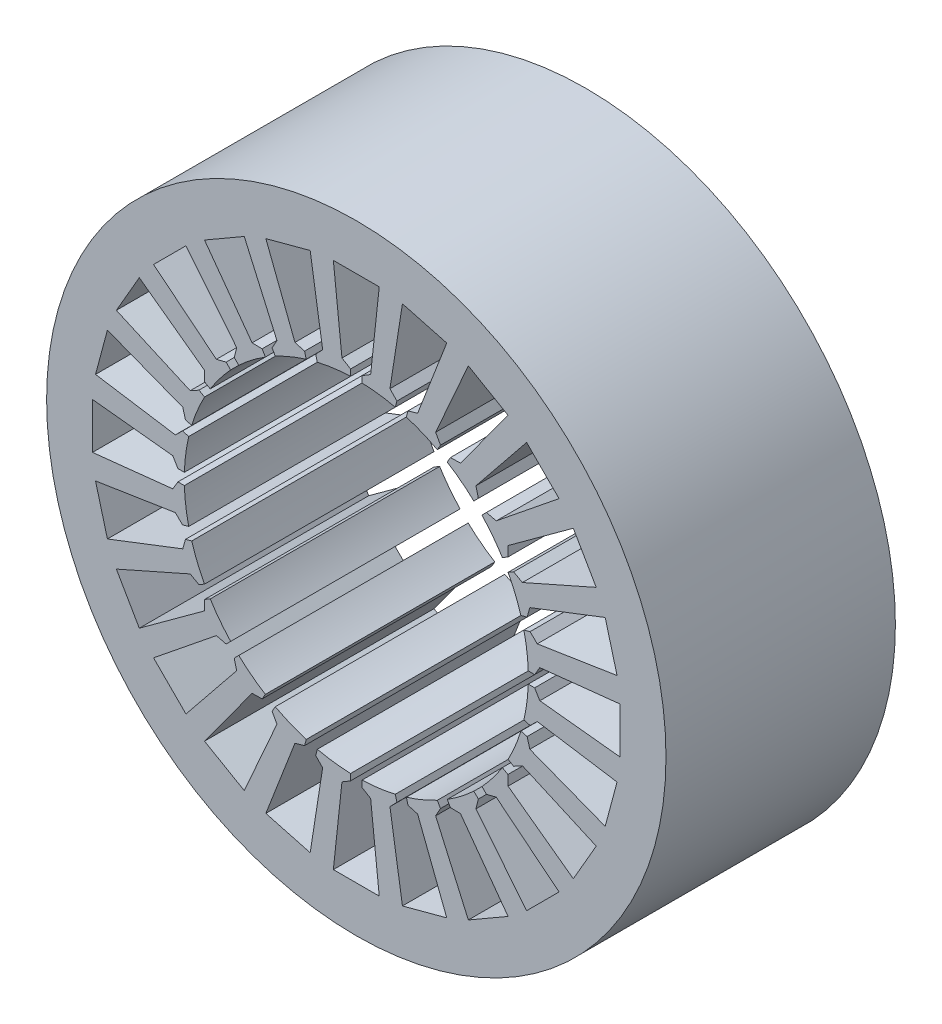
from build123d import *

# Parameters (mm, degrees)
STATOR_STACK_START = -20
SKETCH_1_R         = 54
SKETCH_1_R_2       = 30
STATOR_STACK_DEPTH = 40
STATOR_SLOTS_DEPTH = 21


with BuildPart() as part:
    # Эскиз1 → Stator_stack (new body)
    with BuildSketch(Plane.XY.offset(STATOR_STACK_START)):
        Circle(SKETCH_1_R)
        Circle(SKETCH_1_R_2, mode=Mode.SUBTRACT)
    extrude(amount=STATOR_STACK_DEPTH)

    # Эскиз2 → Stator_slots (cut, symmetric)
    with BuildSketch(Plane.XY):
        Polygon((28.982753492, -1), (31.1, -1), (32, -2.5), (39.5, -3.303571429), (46, -4), (46, 4), (39.5, 3.303571429), (32, 2.5), (31.1, 1), (28.982753492, 1), align=None)
        Polygon((28.25400916, 6.535362757), (30.299112243, 7.083346476), (31.556674054, 5.867394878), (39.009097341, 7.03234732), (45.46786419, 8.04197277), (43.397311829, 15.76937938), (37.299042936, 13.414357243), (30.262578828, 10.697024009), (29.781474152, 9.015198129), (27.73637107, 8.46721441), align=None)
        Polygon((25.599800796, 13.625351342), (27.433390058, 14.683974596), (28.962812921, 13.834936491), (35.859789164, 16.88902322), (41.837168574, 19.535898385), (37.837168574, 26.464101615), (32.556217735, 22.61097678), (26.462812921, 18.165063509), (26.433390058, 16.416025404), (24.599800796, 15.35740215), align=None)
        Polygon((21.201008313, 19.786794751), (22.698127676, 21.283914114), (24.395183951, 20.859650045), (30.266695616, 25.594740098), (35.355339059, 29.69848481), (29.69848481, 35.355339059), (25.594740098, 30.266695616), (20.859650045, 24.395183951), (21.283914114, 22.698127676), (19.786794751, 21.201008313), align=None)
        Polygon((15.35740215, 24.599800796), (16.416025404, 26.433390058), (18.165063509, 26.462812921), (22.61097678, 32.556217735), (26.464101615, 37.837168574), (19.535898385, 41.837168574), (16.88902322, 35.859789164), (13.834936491, 28.962812921), (14.683974596, 27.433390058), (13.625351342, 25.599800796), align=None)
        Polygon((8.46721441, 27.73637107), (9.015198129, 29.781474152), (10.697024009, 30.262578828), (13.414357243, 37.299042936), (15.76937938, 43.397311829), (8.04197277, 45.46786419), (7.03234732, 39.009097341), (5.867394878, 31.556674054), (7.083346476, 30.299112243), (6.535362757, 28.25400916), align=None)
        Polygon((1, 28.982753492), (1, 31.1), (2.5, 32), (3.303571429, 39.5), (4, 46), (-4, 46), (-3.303571429, 39.5), (-2.5, 32), (-1, 31.1), (-1, 28.982753492), align=None)
        Polygon((-6.535362757, 28.25400916), (-7.083346476, 30.299112243), (-5.867394878, 31.556674054), (-7.03234732, 39.009097341), (-8.04197277, 45.46786419), (-15.76937938, 43.397311829), (-13.414357243, 37.299042936), (-10.697024009, 30.262578828), (-9.015198129, 29.781474152), (-8.46721441, 27.73637107), align=None)
        Polygon((-13.625351342, 25.599800796), (-14.683974596, 27.433390058), (-13.834936491, 28.962812921), (-16.88902322, 35.859789164), (-19.535898385, 41.837168574), (-26.464101615, 37.837168574), (-22.61097678, 32.556217735), (-18.165063509, 26.462812921), (-16.416025404, 26.433390058), (-15.35740215, 24.599800796), align=None)
        Polygon((-19.786794751, 21.201008313), (-21.283914114, 22.698127676), (-20.859650045, 24.395183951), (-25.594740098, 30.266695616), (-29.69848481, 35.355339059), (-35.355339059, 29.69848481), (-30.266695616, 25.594740098), (-24.395183951, 20.859650045), (-22.698127676, 21.283914114), (-21.201008313, 19.786794751), align=None)
        Polygon((-24.599800796, 15.35740215), (-26.433390058, 16.416025404), (-26.462812921, 18.165063509), (-32.556217735, 22.61097678), (-37.837168574, 26.464101615), (-41.837168574, 19.535898385), (-35.859789164, 16.88902322), (-28.962812921, 13.834936491), (-27.433390058, 14.683974596), (-25.599800796, 13.625351342), align=None)
        Polygon((-27.73637107, 8.46721441), (-29.781474152, 9.015198129), (-30.262578828, 10.697024009), (-37.299042936, 13.414357243), (-43.397311829, 15.76937938), (-45.46786419, 8.04197277), (-39.009097341, 7.03234732), (-31.556674054, 5.867394878), (-30.299112243, 7.083346476), (-28.25400916, 6.535362757), align=None)
        Polygon((-28.982753492, 1), (-31.1, 1), (-32, 2.5), (-39.5, 3.303571429), (-46, 4), (-46, -4), (-39.5, -3.303571429), (-32, -2.5), (-31.1, -1), (-28.982753492, -1), align=None)
        Polygon((-28.25400916, -6.535362757), (-30.299112243, -7.083346476), (-31.556674054, -5.867394878), (-39.009097341, -7.03234732), (-45.46786419, -8.04197277), (-43.397311829, -15.76937938), (-37.299042936, -13.414357243), (-30.262578828, -10.697024009), (-29.781474152, -9.015198129), (-27.73637107, -8.46721441), align=None)
        Polygon((-25.599800796, -13.625351342), (-27.433390058, -14.683974596), (-28.962812921, -13.834936491), (-35.859789164, -16.88902322), (-41.837168574, -19.535898385), (-37.837168574, -26.464101615), (-32.556217735, -22.61097678), (-26.462812921, -18.165063509), (-26.433390058, -16.416025404), (-24.599800796, -15.35740215), align=None)
        Polygon((-21.201008313, -19.786794751), (-22.698127676, -21.283914114), (-24.395183951, -20.859650045), (-30.266695616, -25.594740098), (-35.355339059, -29.69848481), (-29.69848481, -35.355339059), (-25.594740098, -30.266695616), (-20.859650045, -24.395183951), (-21.283914114, -22.698127676), (-19.786794751, -21.201008313), align=None)
        Polygon((-15.35740215, -24.599800796), (-16.416025404, -26.433390058), (-18.165063509, -26.462812921), (-22.61097678, -32.556217735), (-26.464101615, -37.837168574), (-19.535898385, -41.837168574), (-16.88902322, -35.859789164), (-13.834936491, -28.962812921), (-14.683974596, -27.433390058), (-13.625351342, -25.599800796), align=None)
        Polygon((-8.46721441, -27.73637107), (-9.015198129, -29.781474152), (-10.697024009, -30.262578828), (-13.414357243, -37.299042936), (-15.76937938, -43.397311829), (-8.04197277, -45.46786419), (-7.03234732, -39.009097341), (-5.867394878, -31.556674054), (-7.083346476, -30.299112243), (-6.535362757, -28.25400916), align=None)
        Polygon((-1, -28.982753492), (-1, -31.1), (-2.5, -32), (-3.303571429, -39.5), (-4, -46), (4, -46), (3.303571429, -39.5), (2.5, -32), (1, -31.1), (1, -28.982753492), align=None)
        Polygon((6.535362757, -28.25400916), (7.083346476, -30.299112243), (5.867394878, -31.556674054), (7.03234732, -39.009097341), (8.04197277, -45.46786419), (15.76937938, -43.397311829), (13.414357243, -37.299042936), (10.697024009, -30.262578828), (9.015198129, -29.781474152), (8.46721441, -27.73637107), align=None)
        Polygon((13.625351342, -25.599800796), (14.683974596, -27.433390058), (13.834936491, -28.962812921), (16.88902322, -35.859789164), (19.535898385, -41.837168574), (26.464101615, -37.837168574), (22.61097678, -32.556217735), (18.165063509, -26.462812921), (16.416025404, -26.433390058), (15.35740215, -24.599800796), align=None)
        Polygon((19.786794751, -21.201008313), (21.283914114, -22.698127676), (20.859650045, -24.395183951), (25.594740098, -30.266695616), (29.69848481, -35.355339059), (35.355339059, -29.69848481), (30.266695616, -25.594740098), (24.395183951, -20.859650045), (22.698127676, -21.283914114), (21.201008313, -19.786794751), align=None)
        Polygon((24.599800796, -15.35740215), (26.433390058, -16.416025404), (26.462812921, -18.165063509), (32.556217735, -22.61097678), (37.837168574, -26.464101615), (41.837168574, -19.535898385), (35.859789164, -16.88902322), (28.962812921, -13.834936491), (27.433390058, -14.683974596), (25.599800796, -13.625351342), align=None)
        Polygon((27.73637107, -8.46721441), (29.781474152, -9.015198129), (30.262578828, -10.697024009), (37.299042936, -13.414357243), (43.397311829, -15.76937938), (45.46786419, -8.04197277), (39.009097341, -7.03234732), (31.556674054, -5.867394878), (30.299112243, -7.083346476), (28.25400916, -6.535362757), align=None)
    extrude(amount=STATOR_SLOTS_DEPTH, both=True, mode=Mode.SUBTRACT)


solid = part.part
